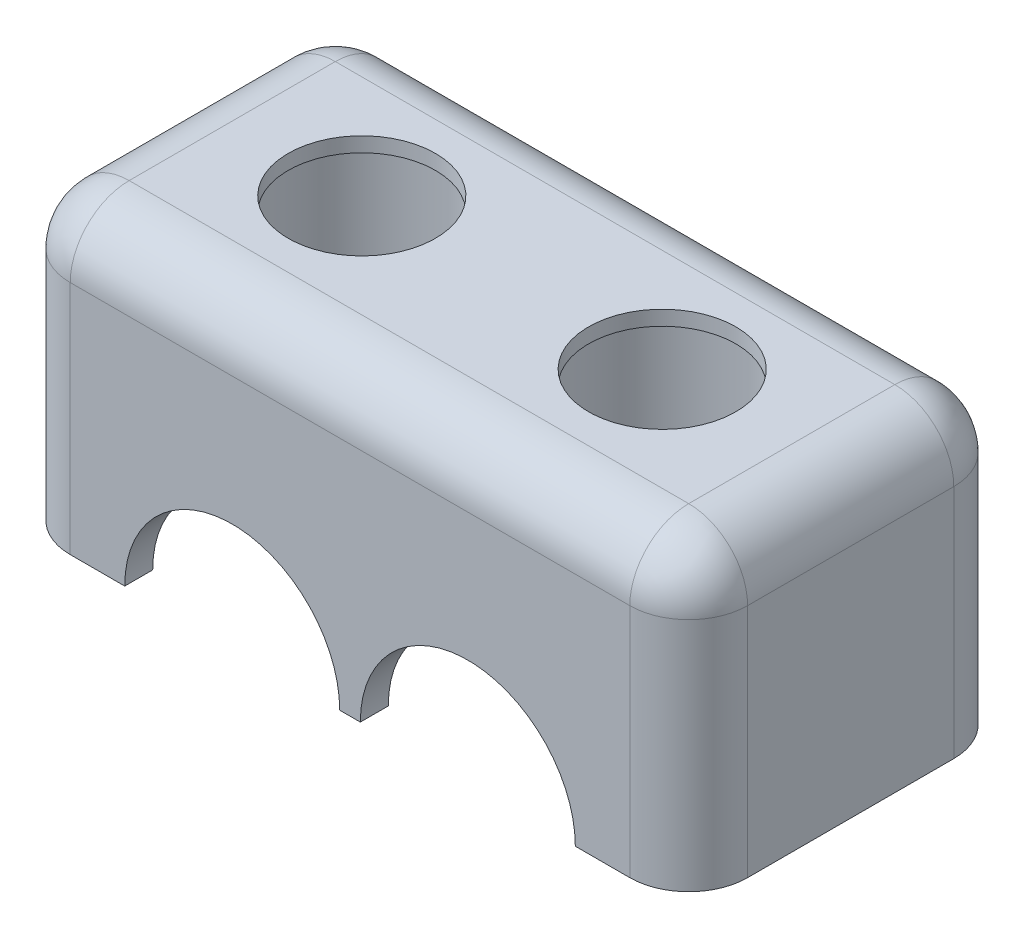
from build123d import *

# Parameters (mm, degrees)
BOSS_EXTRUDE1_DEPTH     = 27.94
CUT_EXTRUDE1_DEPTH      = 48.739163168
CUT_EXTRUDE1_DEPTH_BACK = 48.739163168
SKETCH3_R               = 6.35
CUT_EXTRUDE2_DEPTH      = 48.73916328
CUT_EXTRUDE2_DEPTH_BACK = 24.13
SKETCH4_R               = 8.001
CUT_EXTRUDE3_REACH      = 61.268
CUT_EXTRUDE3_START      = 12.192
SKETCH5_W               = 45.72
SKETCH5_H               = 20.574
SKETCH6_W               = 10.668
SKETCH6_H               = 4.572
CUT_EXTRUDE4_DEPTH      = 2.54
SKETCH7_W               = 12.7
SKETCH7_H               = 11.938
CUT_EXTRUDE5_DEPTH      = 2.54
FILLET1_R               = 5.08
CUT_EXTRUDE6_START      = 3.048
SKETCH8_W               = 48.26
SKETCH8_H               = 23.114
CUT_EXTRUDE6_DEPTH      = 12.7


with BuildPart() as part:
    # Sketch2 → Boss-Extrude1 (new body)
    with BuildSketch(Plane.XY):
        with BuildLine():
            Line((29.21, -5.08), (29.21, -25.4))
            Line((29.21, -25.4), (19.431, -25.4))
            ThreePointArc((19.431, -25.4), (10.16, -16.129), (0.889, -25.4))
            Line((0.889, -25.4), (-0.889, -25.4))
            ThreePointArc((-0.889, -25.4), (-10.16, -16.129), (-19.431, -25.4))
            Line((-19.431, -25.4), (-29.21, -25.4))
            Line((-29.21, -25.4), (-29.21, -5.08))
            ThreePointArc((-29.21, -5.08), (-27.722102448, -1.487897552), (-24.13, 0))
            Line((-24.13, 0), (24.13, 0))
            ThreePointArc((24.13, 0), (27.722102448, -1.487897552), (29.21, -5.08))
        make_face()
    extrude(amount=BOSS_EXTRUDE1_DEPTH)

    # Sketch3 → Cut-Extrude1 (cut, two sides: drawn at the far end of the back side and taken through both)
    with BuildSketch(Plane.XZ.offset(25.4).offset(-CUT_EXTRUDE1_DEPTH_BACK)):
        with Locations(Location((-12.954, 13.97, 0), (0, 0, 270))):
            Circle(SKETCH3_R)
        with Locations(Location((12.954, 13.97, 0), (0, 0, 270))):
            Circle(SKETCH3_R)
    extrude(amount=CUT_EXTRUDE1_DEPTH + CUT_EXTRUDE1_DEPTH_BACK, mode=Mode.SUBTRACT)

    # Sketch4 → Cut-Extrude2 (cut, two sides: drawn at the far end of the back side and taken through both)
    with BuildSketch(Plane.XZ.offset(25.4).offset(-CUT_EXTRUDE2_DEPTH_BACK)):
        with Locations(Location((-12.954, 13.97, 0), (0, 0, 215.950567609))):
            Circle(SKETCH4_R)
        with Locations(Location((12.954, 13.97, 0), (0, 0, 324.04943238))):
            Circle(SKETCH4_R)
    extrude(amount=CUT_EXTRUDE2_DEPTH + CUT_EXTRUDE2_DEPTH_BACK, mode=Mode.SUBTRACT)

    # Cut-Extrude3: up to this face of the body (flat: up to its plane)
    cut_extrude3_end = Plane(part.part.faces().sort_by_distance((-24.47856499, -25.4, 13.97))[0])
    # Sketch5 → Cut-Extrude3 (cut, up to the picked face)
    with BuildSketch(Plane.XZ.offset(1.27).offset(CUT_EXTRUDE3_START), mode=Mode.PRIVATE) as cut_extrude3_sk1:
        with Locations((0, 13.97)):
            Rectangle(SKETCH5_W, SKETCH5_H)
    cut_extrude3_tool1 = split(extrude(cut_extrude3_sk1.sketch, amount=CUT_EXTRUDE3_REACH, mode=Mode.PRIVATE), bisect_by=cut_extrude3_end, keep=Keep.BOTH, mode=Mode.PRIVATE)
    add(cut_extrude3_tool1.solids().sort_by(Axis((0, -13.462, 13.97), (0, -1, 0)))[0], mode=Mode.SUBTRACT)

    # Sketch6 → Cut-Extrude4 (cut)
    with BuildSketch(Plane.XZ.offset(13.462)):
        with Locations((0, 21.971)):
            Rectangle(SKETCH6_W, SKETCH6_H)
    cut_extrude4 = extrude(amount=-CUT_EXTRUDE4_DEPTH, mode=Mode.SUBTRACT)

    # Mirror1: Cut-Extrude4 across plane
    add(cut_extrude4.mirror(Plane.XY.offset(13.97)), mode=Mode.SUBTRACT)

    # Sketch7 → Cut-Extrude5 (cut)
    with BuildSketch(Plane(origin=(0, 0, 0), x_dir=(-1, 0, 0), z_dir=(0, 0, -1))):
        with Locations((0, -19.431)):
            Rectangle(SKETCH7_W, SKETCH7_H)
    extrude(amount=-CUT_EXTRUDE5_DEPTH, mode=Mode.SUBTRACT)

    # Fillet1
    fillet1_edges = [part.edges().sort_by_distance(p)[0] for p in [
        (-29.21, -15.24, 0),
        (-27.722102448, -1.487897552, 0),
        (0, 0, 0),
        (27.722102448, -1.487897552, 27.94),
        (27.722102448, -1.487897552, 0),
        (29.21, -15.24, 0),
        (0, 0, 27.94),
        (-27.722102448, -1.487897552, 27.94),
        (-29.21, -15.24, 27.94),
        (29.21, -15.24, 27.94),
    ]]
    fillet(fillet1_edges, radius=FILLET1_R)

    # Sketch8 → Cut-Extrude6 (cut)
    with BuildSketch(Plane.XZ.offset(13.462).offset(CUT_EXTRUDE6_START)):
        with Locations((0, 13.97)):
            Rectangle(SKETCH8_W, SKETCH8_H)
    extrude(amount=CUT_EXTRUDE6_DEPTH, mode=Mode.SUBTRACT)


solid = part.part
